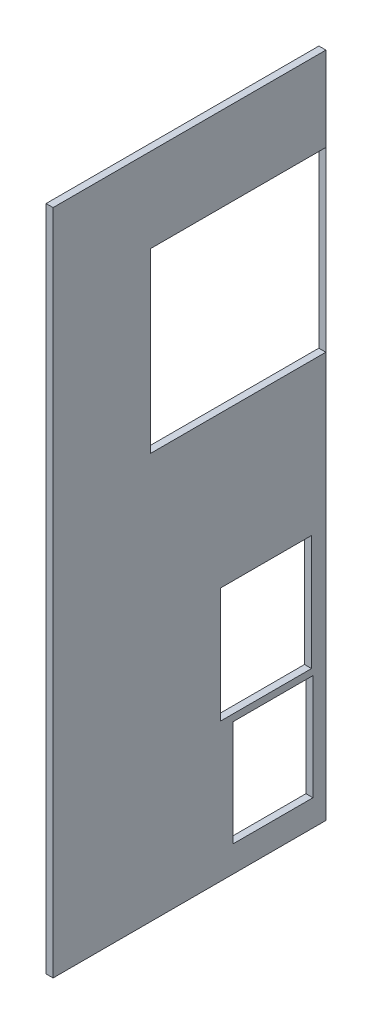
from build123d import *

# Parameters (mm, degrees)
SKETCH_1_W          = 95
SKETCH_1_H          = 38.85
EXTRUDE_1_DEPTH     = 1
SKETCH_2_W          = 11.4
SKETCH_2_H          = 15.06
SKETCH_2_W_2        = 24.986714953
SKETCH_2_H_2        = 25.25
SKETCH_2_W_3        = 12.976860002
SKETCH_2_H_3        = 16.4084
CUT_EXTRUDE_1_DEPTH = 10


with BuildPart() as part:
    # Эскиз1 → Бобышка-Вытянуть1 (new body)
    with BuildSketch(Plane(origin=(0.5, 0, 0), x_dir=(0, -1, 0), z_dir=(-1, 0, 0))):
        with Locations((-53.35, 22.825)):
            Rectangle(SKETCH_1_W, SKETCH_1_H)
    extrude(amount=-EXTRUDE_1_DEPTH)

    # Эскиз2 → Вырез-Вытянуть1 (cut)
    with BuildSketch(Plane.ZY.offset(-0.5)):
        with Locations((10.95, 17.108135831)):
            Rectangle(SKETCH_2_W, SKETCH_2_H)
        with Locations((15.906642524, 76.225)):
            Rectangle(SKETCH_2_W_2, SKETCH_2_H_2)
        with Locations((11.944169999, 33.813361354)):
            Rectangle(SKETCH_2_W_3, SKETCH_2_H_3)
    extrude(amount=-CUT_EXTRUDE_1_DEPTH, mode=Mode.SUBTRACT)


solid = part.part
